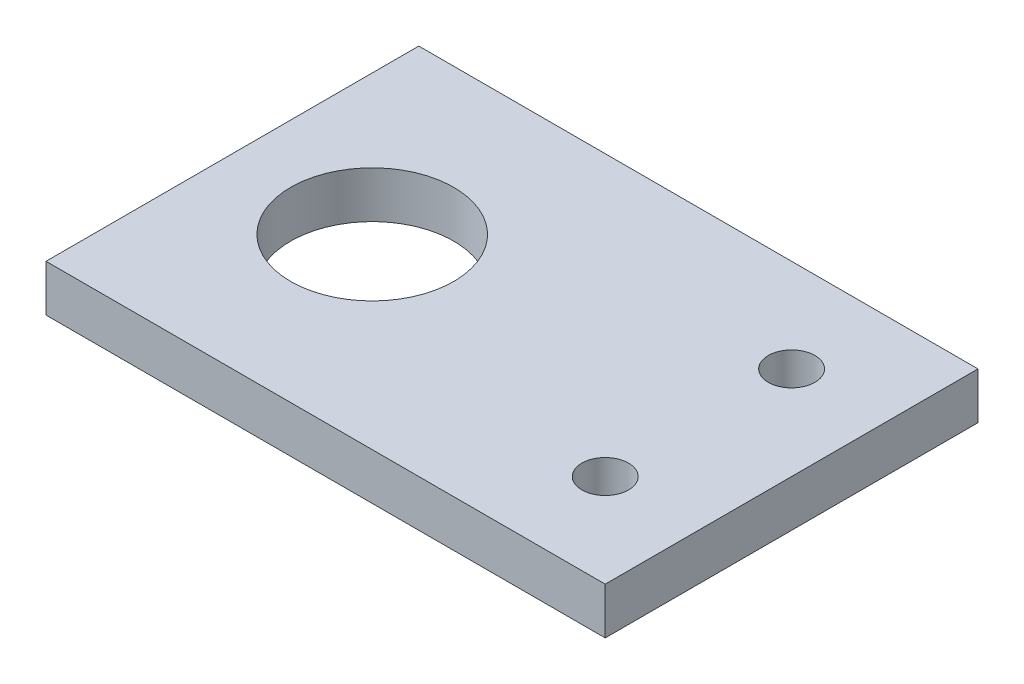
from build123d import *

# Parameters (mm, degrees)
SKETCH1_W           = 76.2
SKETCH1_H           = 50.8
BOSS_EXTRUDE1_DEPTH = 6.35
SKETCH2_R           = 11.1125
SKETCH2_R_2         = 3.175
CUT_EXTRUDE1_DEPTH  = 189.597029751


with BuildPart() as part:
    # Sketch1 → Boss-Extrude1 (new body)
    with BuildSketch(Plane(origin=(0, 0, 0), x_dir=(1, 0, 0), z_dir=(0, 1, 0))):
        with Locations((-140.868344582, 33.751067349)):
            Rectangle(SKETCH1_W, SKETCH1_H)
    extrude(amount=BOSS_EXTRUDE1_DEPTH)

    # Sketch2 → Cut-Extrude1 (cut, through all)
    with BuildSketch(Plane(origin=(0, 6.35, 0), x_dir=(1, 0, 0), z_dir=(0, 1, 0))):
        with Locations(Location((-159.918344582, 33.751067349, 0), (0, 0, 270))):
            Circle(SKETCH2_R)
        with Locations(Location((-115.468344582, 46.451067349, 0), (0, 0, 270))):
            Circle(SKETCH2_R_2)
        with Locations(Location((-115.468344582, 21.051067349, 0), (0, 0, 270))):
            Circle(SKETCH2_R_2)
    extrude(amount=-CUT_EXTRUDE1_DEPTH, mode=Mode.SUBTRACT)


solid = part.part
